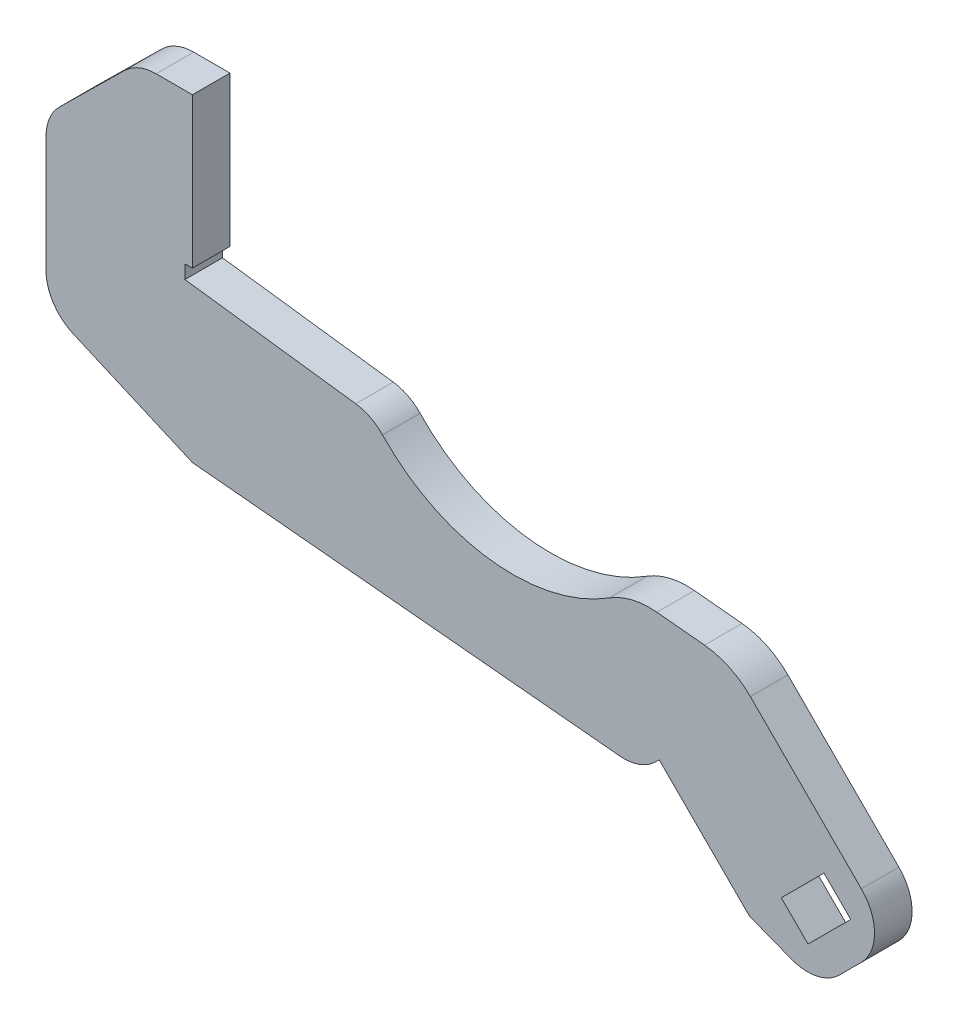
from build123d import *

# Parameters (mm, degrees)
BOSS_EXTRUDE1_DEPTH = 0.125
FILLET1_R           = 0.3
FILLET2_R           = 0.5


with BuildPart() as part:
    # frame_outline → Boss-Extrude1 (new, symmetric)
    with BuildSketch(Plane.XY):
        with BuildLine():
            Line((-0.05, -0.6), (-0.05, -1.6))
            Line((-0.05, -1.6), (-0.1, -1.6))
            Line((-0.1, -1.6), (-0.1, -1.690631342))
            Line((-0.1, -1.690631342), (1.149530794, -1.853054692))
            ThreePointArc((1.149530794, -1.853054692), (1.967232196, -2.294374324), (2.854868829, -2.019602037))
            Line((2.854868829, -2.019602037), (3.538793019, -2.08639569))
            Line((3.538793019, -2.08639569), (4.616700174, -3.164302846))
            Line((4.616700174, -3.164302846), (4.120311214, -3.660691806))
            Line((4.120311214, -3.660691806), (3.659277593, -3.482500897))
            Line((3.659277593, -3.482500897), (3.058236829, -2.881460133))
            Line((3.058236829, -2.881460133), (2.935621241, -3.004075721))
            Line((2.935621241, -3.004075721), (-0.05, -2.721174788))
            Line((-0.05, -2.721174788), (-1.025048244, -2.297249495))
            Line((-1.025048244, -2.297249495), (-1.025048244, -1.201582707))
            Line((-1.025048244, -1.201582707), (-0.414440871, -0.6))
            Line((-0.414440871, -0.6), (-0.05, -0.6))
        make_face()
        Polygon((3.871409627, -3.270368863), (4.049600536, -3.448559772), (4.333857462, -3.164302846), (4.155666553, -2.986111937), align=None, mode=Mode.SUBTRACT)
    extrude(amount=BOSS_EXTRUDE1_DEPTH, both=True)

    # Fillet1
    fillet1_edges = [part.edges().sort_by_distance(p)[0] for p in [
        (-1.025048244, -1.201582707, 0),
        (-0.414440871, -0.6, 0),
        (1.149530794, -1.853054692, 0),
        (4.616700174, -3.164302846, 0),
        (4.120311214, -3.660691806, 0),
        (2.935621241, -3.004075721, 0),
        (-1.025048244, -2.297249495, 0),
    ]]
    fillet(fillet1_edges, radius=FILLET1_R)

    # Fillet2
    fillet2_edges = [part.edges().sort_by_distance(p)[0] for p in [
        (2.854868829, -2.019602037, 0),
        (3.538793019, -2.08639569, 0),
    ]]
    fillet(fillet2_edges, radius=FILLET2_R)


solid = part.part
